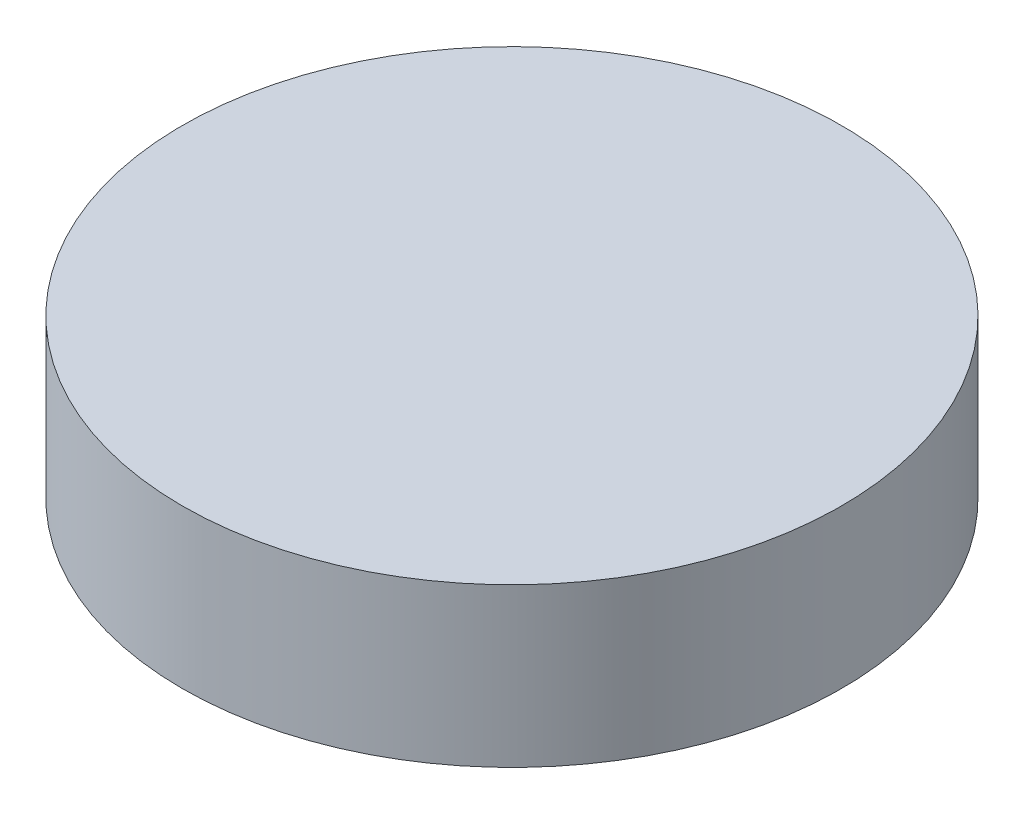
from build123d import *

# Parameters (mm, degrees)
SKETCH1_R                  = 25
TOPPING_AYAR_AYAGI_1_DEPTH = 12


with BuildPart() as part:
    # Sketch1 → TOPPING_ayar_ayagi_1 (new body)
    with BuildSketch(Plane(origin=(0, 0, 0), x_dir=(1, 0, 0), z_dir=(0, 1, 0))):
        with Locations(Location((50, 50, 0), (0, 0, 270))):
            Circle(SKETCH1_R)
    extrude(amount=TOPPING_AYAR_AYAGI_1_DEPTH)


solid = part.part
